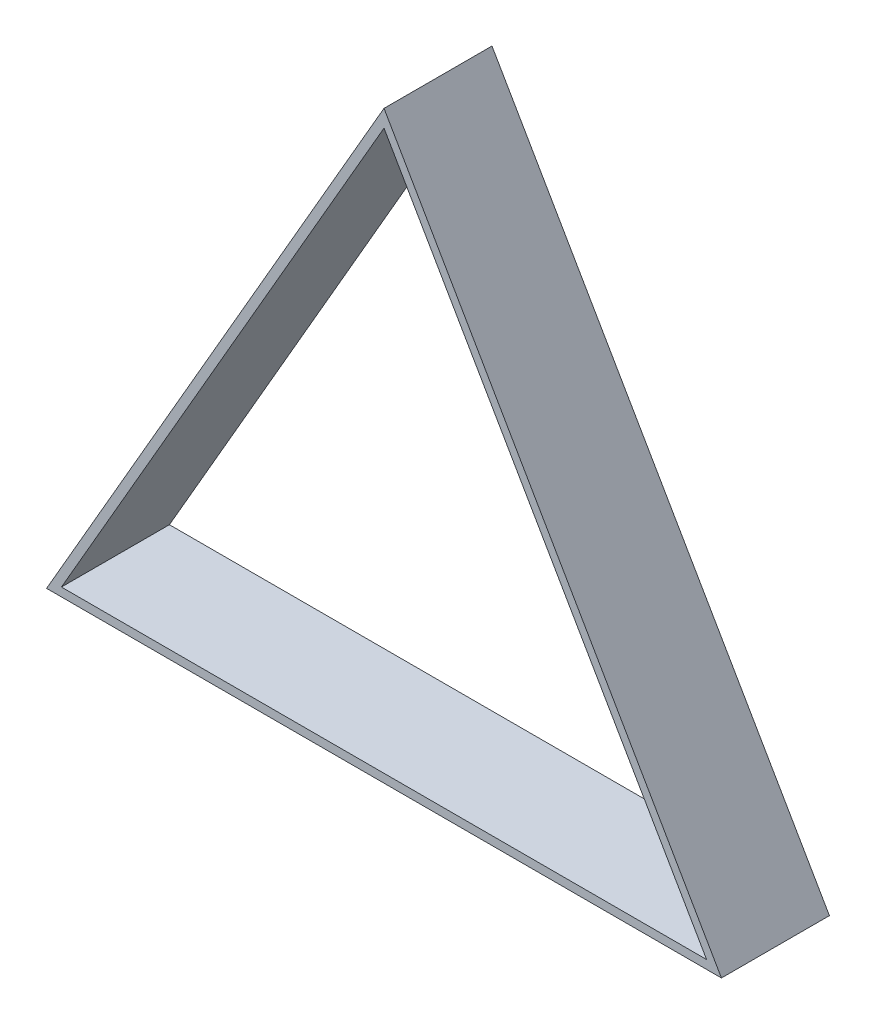
from build123d import *

# Parameters (mm, degrees)
BOSS_EXTRUDE2_DEPTH = 40


with BuildPart() as part:
    # Sketch2 → Boss-Extrude2 (new body)
    with BuildSketch(Plane.XY):
        Polygon((0, 0), (125, 216.506350946), (250, 0), align=None)
        Polygon((125, 210.156350946), (5.499261314, 3.175), (244.500738686, 3.175), align=None, mode=Mode.SUBTRACT)
    extrude(amount=BOSS_EXTRUDE2_DEPTH)


solid = part.part
